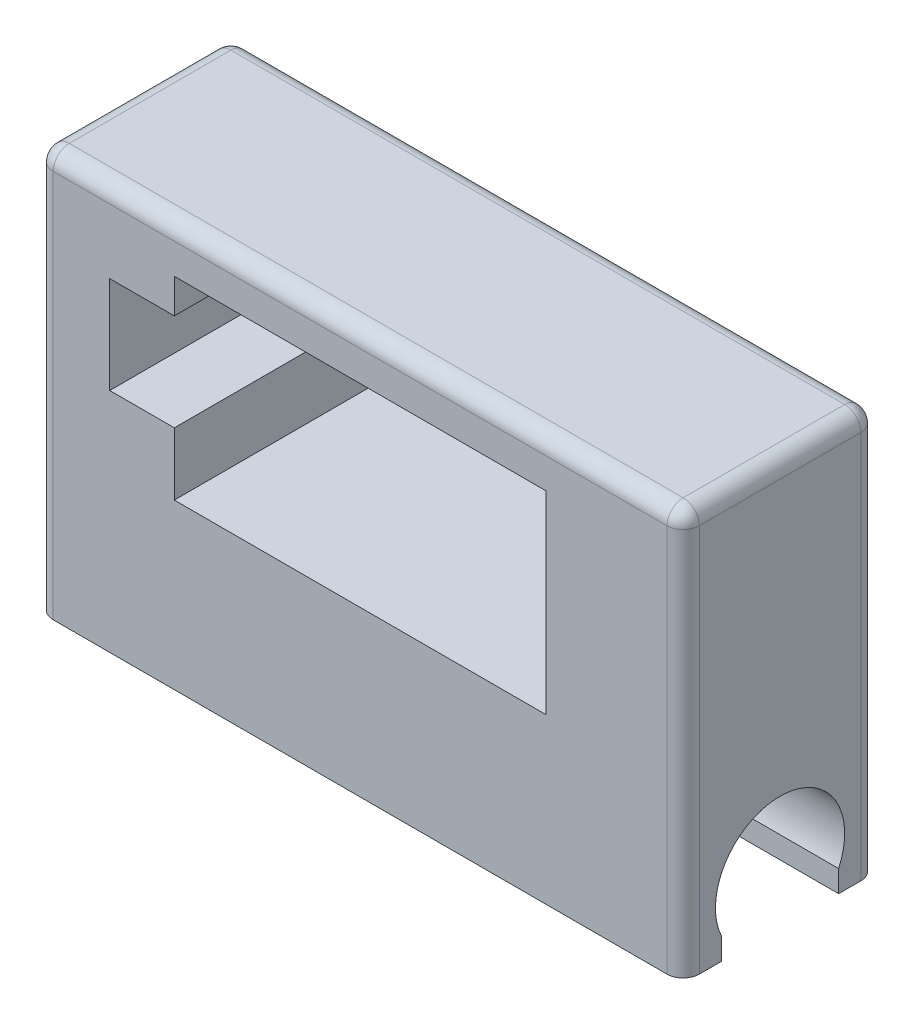
from build123d import *

# Parameters (mm, degrees)
BOSS_EXTRUDE1_DEPTH = 40
SKETCH2_W           = 40
SKETCH2_H           = 16
BOSS_EXTRUDE2_DEPTH = 12
FILLET1_R           = 1


with BuildPart() as part:
    # Sketch1 → Boss-Extrude1 (new body)
    with BuildSketch(Plane(origin=(0, 0, 0), x_dir=(0, 0, -1), z_dir=(1, 0, 0))):
        with BuildLine():
            Line((-3.625, -1.690968657), (-3.625, -3.041889066))
            Line((-3.625, -3.041889066), (-6, -3.041889066))
            Line((-6, -3.041889066), (-6, 6))
            Line((-6, 6), (6, 6))
            Line((6, 6), (6, -3.041889066))
            Line((6, -3.041889066), (3.625, -3.041889066))
            Line((3.625, -3.041889066), (3.625, -1.690968657))
            ThreePointArc((3.625, -1.690968657), (0, 4), (-3.625, -1.690968657))
        make_face()
    extrude(amount=BOSS_EXTRUDE1_DEPTH)

    # Sketch2 → Boss-Extrude2 (add)
    with BuildSketch(Plane.XY.offset(6)):
        with Locations((20, 14)):
            Rectangle(SKETCH2_W, SKETCH2_H)
        Polygon((8.5, 17), (8.5, 19.125), (31.5, 19.125), (31.5, 7.125), (8.5, 7.125), (8.5, 11), (4.5, 11), (4.5, 17), align=None, mode=Mode.SUBTRACT)
    extrude(amount=-BOSS_EXTRUDE2_DEPTH)

    # Fillet1
    fillet1_edges = [part.edges().sort_by_distance(p)[0] for p in [
        (40, 9.479055467, -6),
        (40, 22, 0),
        (0, 22, 0),
        (20, 22, 6),
        (20, 22, -6),
        (40, 9.479055467, 6),
        (0, 9.479055467, 6),
        (0, 9.479055467, -6),
    ]]
    fillet(fillet1_edges, radius=FILLET1_R)


solid = part.part
